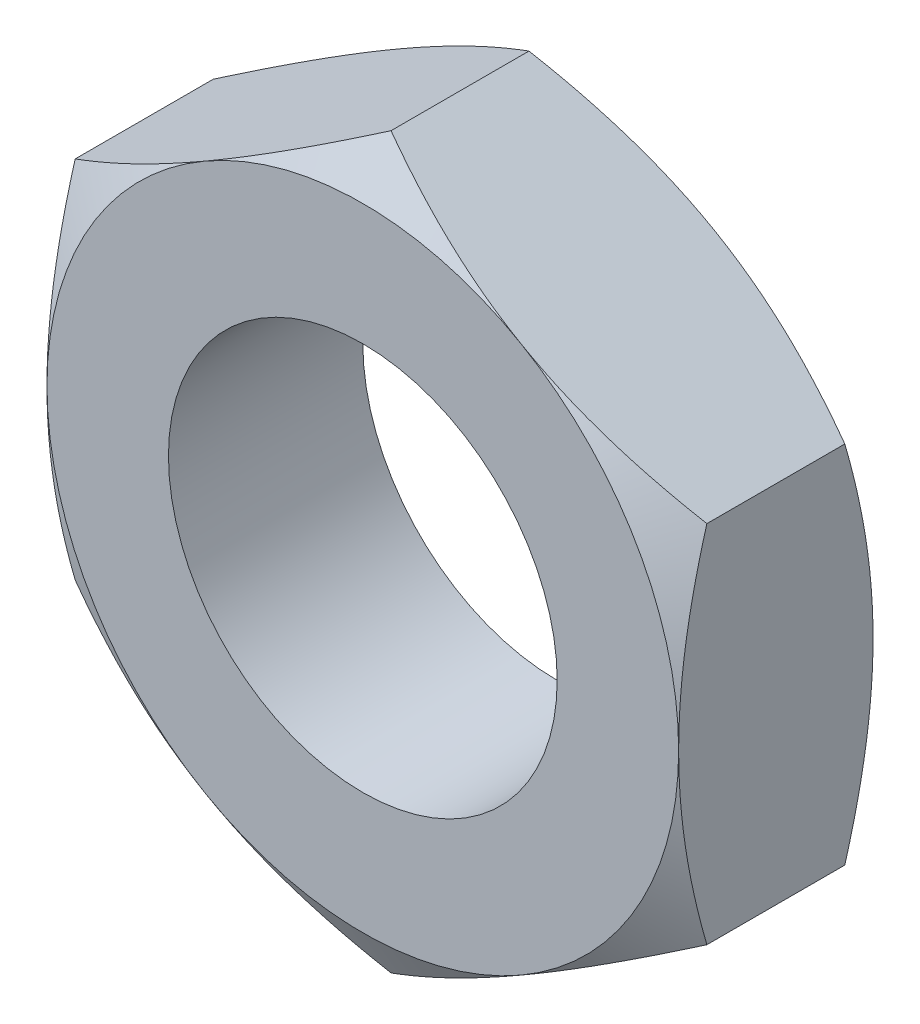
from build123d import *

# Parameters (mm, degrees)
SZKIC1_R                    = 4
DODANIE_WYCI_GNI_CIE1_DEPTH = 2
SZKIC2_OUTSIDE_W            = 32.908
SZKIC2_OUTSIDE_H            = 34.92
SZKIC2_OUTSIDE_R            = 6.5
WYTNIJ_WYCI_GNI_CIE2_DEPTH  = 4
WYTNIJ_WYCI_GNI_CIE2_DRAFT  = -60
LUSTRO1_COPY_1_SKETCH_W     = 32.908
LUSTRO1_COPY_1_SKETCH_H     = 34.92
LUSTRO1_COPY_1_SKETCH_R     = 6.5
LUSTRO1_COPY_1_DEPTH        = 4
LUSTRO1_COPY_1_DRAFT        = -60


with BuildPart() as part:
    # Szkic1 → Dodanie-wyciągnięcie1 (new, symmetric)
    with BuildSketch(Plane.XY):
        Polygon((-6.5, 3.75277675), (-6.5, -3.75277675), (0, -7.505553499), (6.5, -3.75277675), (6.5, 3.75277675), (0, 7.505553499), align=None)
        Circle(SZKIC1_R, mode=Mode.SUBTRACT)
    extrude(amount=DODANIE_WYCI_GNI_CIE1_DEPTH, both=True)


with BuildPart() as wytnij_wyci_gni_cie2_tool:
    # Szkic2 outside → Wytnij-wyciągnięcie2 (with draft: the straight prism first)
    with BuildSketch(Plane.XY.offset(2)):
        Rectangle(SZKIC2_OUTSIDE_W, SZKIC2_OUTSIDE_H)
        Circle(SZKIC2_OUTSIDE_R, mode=Mode.SUBTRACT)
    extrude(amount=-WYTNIJ_WYCI_GNI_CIE2_DEPTH)
    # Wytnij-wyciągnięcie2: the draft: its side faces are tilted about the plane it starts from
    wytnij_wyci_gni_cie2_sides = [wytnij_wyci_gni_cie2_tool.faces().sort_by_distance(p)[0] for p in [
        (0, -17.46, 0),
        (16.454, 0, 0),
        (0, 17.46, 0),
        (-16.454, 0, 0),
        (-6.5, 0, 0),
    ]]
    draft(wytnij_wyci_gni_cie2_sides, Plane.XY.offset(2), WYTNIJ_WYCI_GNI_CIE2_DRAFT)


with BuildPart() as part_1:
    add(part.part)

    # Wytnij-wyciągnięcie2: cut by wytnij_wyci_gni_cie2_tool
    add(wytnij_wyci_gni_cie2_tool.part, mode=Mode.SUBTRACT)


with BuildPart() as lustro1_copy_1_tool:
    # Lustro1 copy 1 sketch → Lustro1 copy 1 (with draft: the straight prism first)
    with BuildSketch(Plane(origin=(0, 0, -2), x_dir=(1, 0, 0), z_dir=(0, 0, -1))):
        Rectangle(LUSTRO1_COPY_1_SKETCH_W, LUSTRO1_COPY_1_SKETCH_H)
        Circle(LUSTRO1_COPY_1_SKETCH_R, mode=Mode.SUBTRACT)
    extrude(amount=-LUSTRO1_COPY_1_DEPTH)
    # Lustro1 copy 1: the draft: its side faces are tilted about the plane it starts from
    lustro1_copy_1_sides = [lustro1_copy_1_tool.faces().sort_by_distance(p)[0] for p in [
        (0, -17.46, 0),
        (16.454, 0, 0),
        (0, 17.46, 0),
        (-16.454, 0, 0),
        (-6.5, 0, 0),
    ]]
    draft(lustro1_copy_1_sides, Plane(origin=(0, 0, -2), x_dir=(1, 0, 0), z_dir=(0, 0, -1)), LUSTRO1_COPY_1_DRAFT)


with BuildPart() as part_2:
    add(part_1.part)

    # Lustro1 copy 1: cut by lustro1_copy_1_tool
    add(lustro1_copy_1_tool.part, mode=Mode.SUBTRACT)


solid = part_2.part
